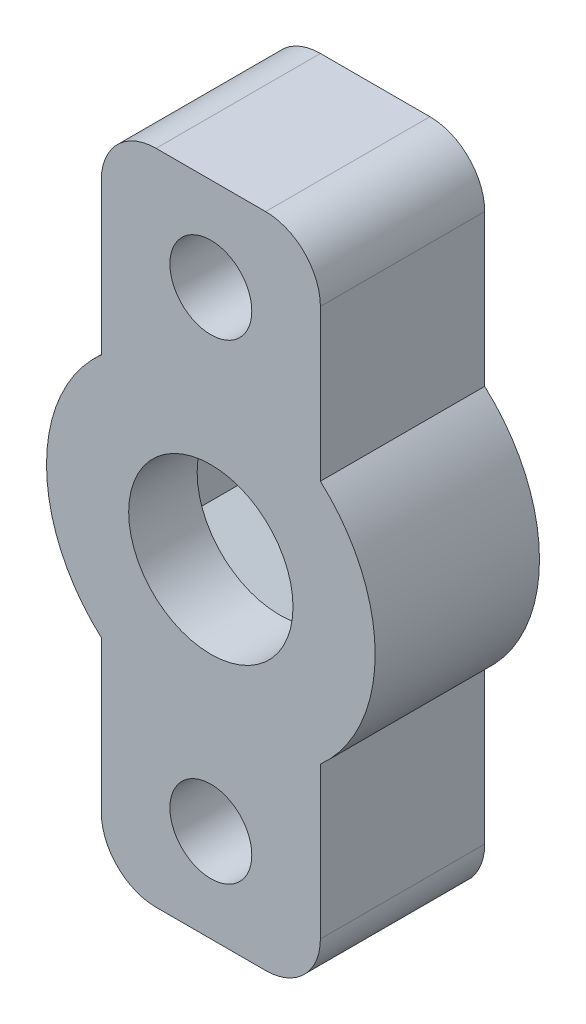
from build123d import *

# Parameters (mm, degrees)
EXTRUDE_1_DEPTH           = 7.62
CUT_EXTRUDE_1_DEPTH       = 4.445
SKETCH_3_R                = 3.81
CUT_EXTRUDE_2_DEPTH       = 6.096
F_6_CLEARANCE_HOLE1_D     = 3.7973
F_6_CLEARANCE_HOLE1_DEPTH = 25.4
F_6_CLEARANCE_HOLE1_TIP   = 1.140824014


with BuildPart() as part:
    # 草图1 → 凸台-拉伸1 (new body)
    with BuildSketch(Plane.XY):
        with BuildLine():
            Line((-5.08, 12.7), (-5.08, 5.679612663))
            ThreePointArc((-5.08, 5.679612663), (-7.62, 0), (-5.08, -5.679612663))
            Line((-5.08, -5.679612663), (-5.08, -12.7))
            ThreePointArc((-5.08, -12.7), (-4.336051224, -14.496051224), (-2.54, -15.24))
            Line((-2.54, -15.24), (2.54, -15.24))
            ThreePointArc((2.54, -15.24), (4.336051224, -14.496051224), (5.08, -12.7))
            Line((5.08, -12.7), (5.08, -5.679612663))
            ThreePointArc((5.08, -5.679612663), (7.62, 0), (5.08, 5.679612663))
            Line((5.08, 5.679612663), (5.08, 12.7))
            ThreePointArc((5.08, 12.7), (4.336051224, 14.496051224), (2.54, 15.24))
            Line((2.54, 15.24), (-2.54, 15.24))
            ThreePointArc((-2.54, 15.24), (-4.336051224, 14.496051224), (-5.08, 12.7))
        make_face()
    extrude(amount=EXTRUDE_1_DEPTH)

    # 草图2 → 切除-拉伸1 (cut)
    with BuildSketch(Plane(origin=(0, 0, 0), x_dir=(-1, 0, 0), z_dir=(0, 0, -1))):
        Polygon((5.55625, 3.207902433), (0, 6.415804866), (-5.55625, 3.207902433), (-5.55625, -3.207902433), (0, -6.415804866), (5.55625, -3.207902433), align=None)
    extrude(amount=-CUT_EXTRUDE_1_DEPTH, mode=Mode.SUBTRACT)

    # 草图3 → 切除-拉伸2 (cut)
    with BuildSketch(Plane(origin=(0, 0, 4.445), x_dir=(-1, 0, 0), z_dir=(0, 0, -1))):
        Circle(SKETCH_3_R)
    extrude(amount=-CUT_EXTRUDE_2_DEPTH, mode=Mode.SUBTRACT)

    # #6 Clearance Hole1
    with Locations(Plane(origin=(0, 0, 0), x_dir=(-1, 0, 0), z_dir=(0, 0, -1))):
        with Locations((0, 10.922), (0, -10.922)):
            Hole(F_6_CLEARANCE_HOLE1_D / 2, depth=F_6_CLEARANCE_HOLE1_DEPTH)
            with Locations((0, 0, -(F_6_CLEARANCE_HOLE1_DEPTH + F_6_CLEARANCE_HOLE1_TIP / 2))):  # 118° drill point
                Cone(0, F_6_CLEARANCE_HOLE1_D / 2, F_6_CLEARANCE_HOLE1_TIP, mode=Mode.SUBTRACT)


solid = part.part
